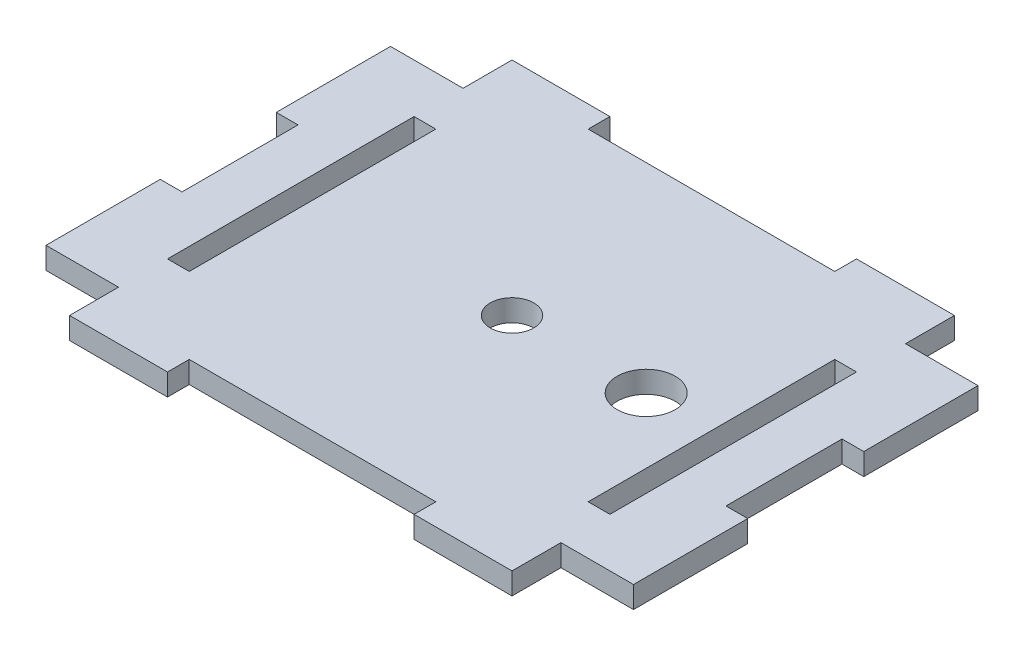
from build123d import *

# Parameters (mm, degrees)
CROQUIS1_R              = 3
CROQUIS1_R_2            = 4
SALIENTE_EXTRUIR1_DEPTH = 3


with BuildPart() as part:
    # Croquis1 → Saliente-Extruir1 (new body)
    with BuildSketch(Plane(origin=(0, 0, 0), x_dir=(1, 0, 0), z_dir=(0, 1, 0))):
        Polygon((17, 27.5), (0, 27.5), (-17, 27.5), (-17, 30.5), (-23.75, 30.5), (-30.5, 30.5), (-30.5, 23.75), (-40.5, 23.75), (-40.5, 8), (-37.5, 8), (-37.5, 0), (-37.5, -8), (-40.5, -8), (-40.5, -23.75), (-30.5, -23.75), (-30.5, -30.5), (-23.75, -30.5), (-17, -30.5), (-17, -27.5), (0, -27.5), (17, -27.5), (17, -30.5), (23.75, -30.5), (30.5, -30.5), (30.5, -23.75), (40.5, -23.75), (40.5, -8), (37.5, -8), (37.5, 0), (37.5, 8), (40.5, 8), (40.5, 23.75), (30.5, 23.75), (30.5, 30.5), (23.75, 30.5), (17, 30.5), align=None)
        Polygon((30.5, 17), (30.5, -17), (27.5, -17), (27.5, 0), (27.5, 17), align=None, mode=Mode.SUBTRACT)
        Polygon((-27.5, 17), (-27.5, 0), (-27.5, -17), (-30.5, -17), (-30.5, 17), align=None, mode=Mode.SUBTRACT)
        with Locations(Location((0, 0, 0), (0, 0, 270))):
            Circle(CROQUIS1_R, mode=Mode.SUBTRACT)
        with Locations(Location((18.5, 0, 0), (0, 0, 270))):
            Circle(CROQUIS1_R_2, mode=Mode.SUBTRACT)
    extrude(amount=SALIENTE_EXTRUIR1_DEPTH)


solid = part.part
